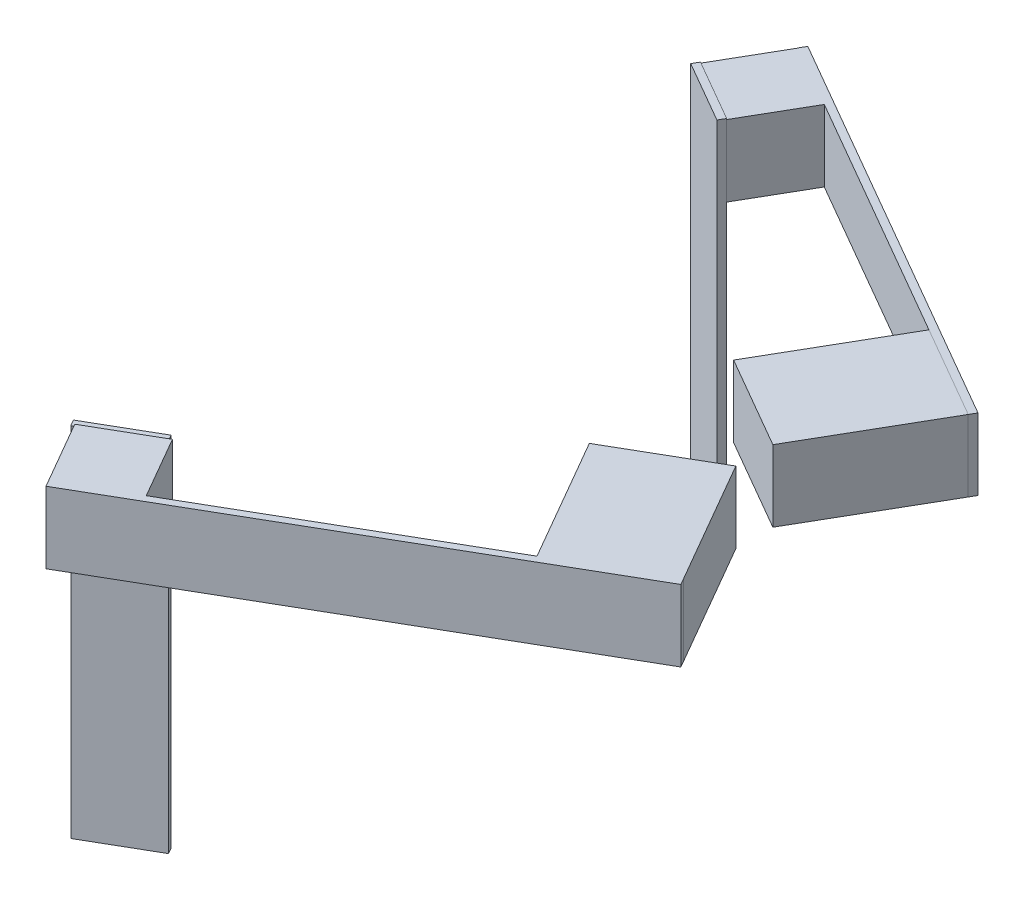
from build123d import *

# Parameters (mm, degrees)
EXTRUDE_1_DEPTH   = 20
EXTRUDE_1_2_DEPTH = 20
EXTRUDE_2_DEPTH   = 20
SKETCH_5_W        = 20
SKETCH_5_H        = 20
EXTRUDE_3_DEPTH   = 20
SKETCH_6_W        = 20
SKETCH_6_H        = 20
EXTRUDE_4_DEPTH   = 20
SKETCH_7_W        = 20
SKETCH_7_H        = 100
EXTRUDE_5_DEPTH   = 2
SKETCH_8_W        = 20
SKETCH_8_H        = 100
EXTRUDE_6_DEPTH   = 2


with BuildPart() as part:
    # 草图3 → 凸台-拉伸1 (new body)
    with BuildSketch(Plane(origin=(0, 0, 0), x_dir=(1, 0, 0), z_dir=(0, 1, 0))):
        Polygon((-48.970199781, -5.178947258), (-74.950961894, -20.178947258), (-54.950961894, -54.81996341), (-28.970199781, -39.81996341), align=None)
    extrude(amount=EXTRUDE_1_DEPTH)

    # 草图4 → 凸台-拉伸2 (add)
    with BuildSketch(Plane(origin=(0, 0, 0), x_dir=(1, 0, 0), z_dir=(0, 1, 0))):
        Polygon((-28.970199781, -39.81996341), (-141.556509073, -104.814755201), (-140.558949664, -106.542763385), (-27.972640372, -41.547971593), align=None)
        Polygon((-28.970199776, 39.81996341), (-141.561064948, 104.806862704), (-140.561266498, 106.539029861), (-27.970401326, 41.552130566), align=None)
    extrude(amount=EXTRUDE_2_DEPTH)


with BuildPart() as body_2:
    # 草图3 → Extrude 1 2 (new body)
    with BuildSketch(Plane(origin=(0, 0, 0), x_dir=(1, 0, 0), z_dir=(0, 1, 0))):
        Polygon((-48.970199776, 5.178947259), (-74.95096189, 20.178947259), (-54.95096189, 54.81996341), (-28.970199776, 39.81996341), align=None)
    extrude(amount=EXTRUDE_1_2_DEPTH)


with BuildPart() as extrude_2_piece_1:
    # of the separate pieces the step leaves, piece 1, a body of its own (extrude_2_pieces)
    add(part.part.solids().sort_by_distance((-48.970199781, 0, 5.178947258))[0])

    # 草图5 → 凸台-拉伸3 (add)
    with BuildSketch(Plane(origin=(10.000239475, 0, 17.322773464), x_dir=(-0.8660485330140629, 0, 0.4999599368591344), z_dir=(-0.49995993685913437, 0, -0.8660485330140628))):
        with Locations((164.997985413, 10)):
            Rectangle(SKETCH_5_W, SKETCH_5_H)
    extrude(amount=EXTRUDE_3_DEPTH)

    # 草图7 → 凸台-拉伸5 (add)
    with BuildSketch(Plane(origin=(0.001040738, 0, 0.001802803), x_dir=(-0.8660485330140629, 0, 0.4999599368591345), z_dir=(-0.4999599368591345, 0, -0.8660485330140629))):
        with Locations((165.811665731, -30.506267148)):
            Rectangle(SKETCH_7_W, SKETCH_7_H)
    extrude(amount=EXTRUDE_5_DEPTH)


with BuildPart() as extrude_2_piece_2:
    # of the separate pieces the step leaves, piece 2, a body of its own (extrude_2_pieces)
    add(part.part.solids().sort_by_distance((-28.970199776, 0, -39.81996341))[0])

    # 草图6 → 凸台-拉伸4 (add)
    with BuildSketch(Plane(origin=(10.000601964, 0, -17.326206352), x_dir=(0.8660835782445356, 0, 0.4998992253396093), z_dir=(-0.49989922533960923, 0, 0.8660835782445355))):
        with Locations((-164.94245125, 10)):
            Rectangle(SKETCH_6_W, SKETCH_6_H)
    extrude(amount=EXTRUDE_4_DEPTH)

    # 草图8 → 凸台-拉伸6 (add)
    with BuildSketch(Plane(origin=(0.002617457, 0, -0.004534787), x_dir=(0.8660835782445356, 0, 0.4998992253396092), z_dir=(-0.4998992253396092, 0, 0.8660835782445356))):
        with Locations((-164.900062676, -29.71065336)):
            Rectangle(SKETCH_8_W, SKETCH_8_H)
    extrude(amount=EXTRUDE_6_DEPTH)


solid = Compound([body_2.part, extrude_2_piece_1.part, extrude_2_piece_2.part])
